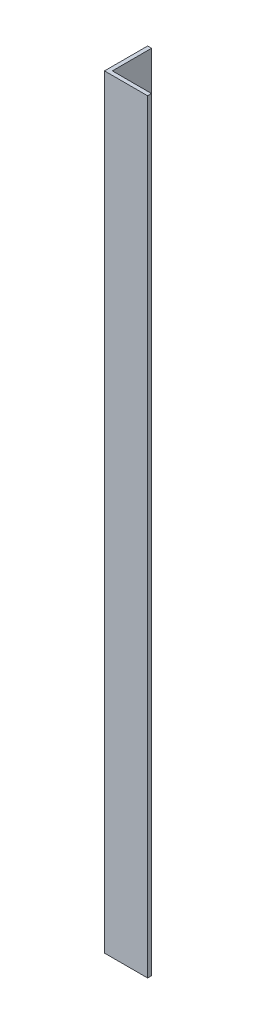
from build123d import *

# Parameters (mm, degrees)
EXTRUDE_1_DEPTH = 390


with BuildPart() as part:
    # Эскиз1 → Вытянуть1 (new body)
    with BuildSketch(Plane(origin=(0, 0, 0), x_dir=(1, 0, 0), z_dir=(0, 1, 0))):
        Polygon((0, -1.071873395), (0, -21.071873395), (20, -21.071873395), (20, -23.071873395), (-2, -23.071873395), (-2, -1.071873395), align=None)
    extrude(amount=EXTRUDE_1_DEPTH)


solid = part.part
